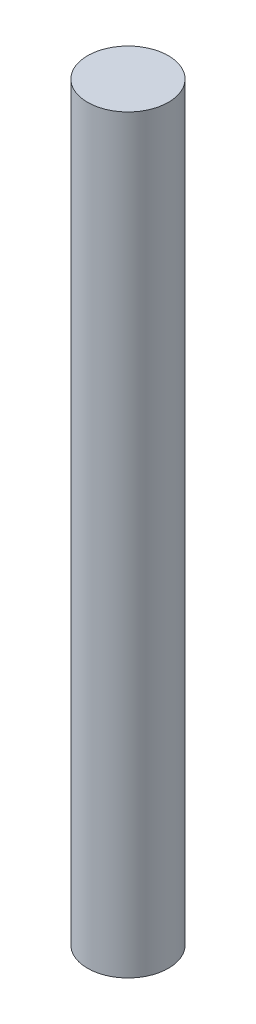
from build123d import *

# Parameters (mm, degrees)
SKETCH1_R           = 1.25
BOSS_EXTRUDE1_DEPTH = 23.2


with BuildPart() as part:
    # Sketch1 → Boss-Extrude1 (new body)
    with BuildSketch(Plane(origin=(0, 0, 0), x_dir=(1, 0, 0), z_dir=(0, 1, 0))):
        with Locations(Location((0, 0, 0), (0, 0, 270))):
            Circle(SKETCH1_R)
    extrude(amount=BOSS_EXTRUDE1_DEPTH)


solid = part.part
